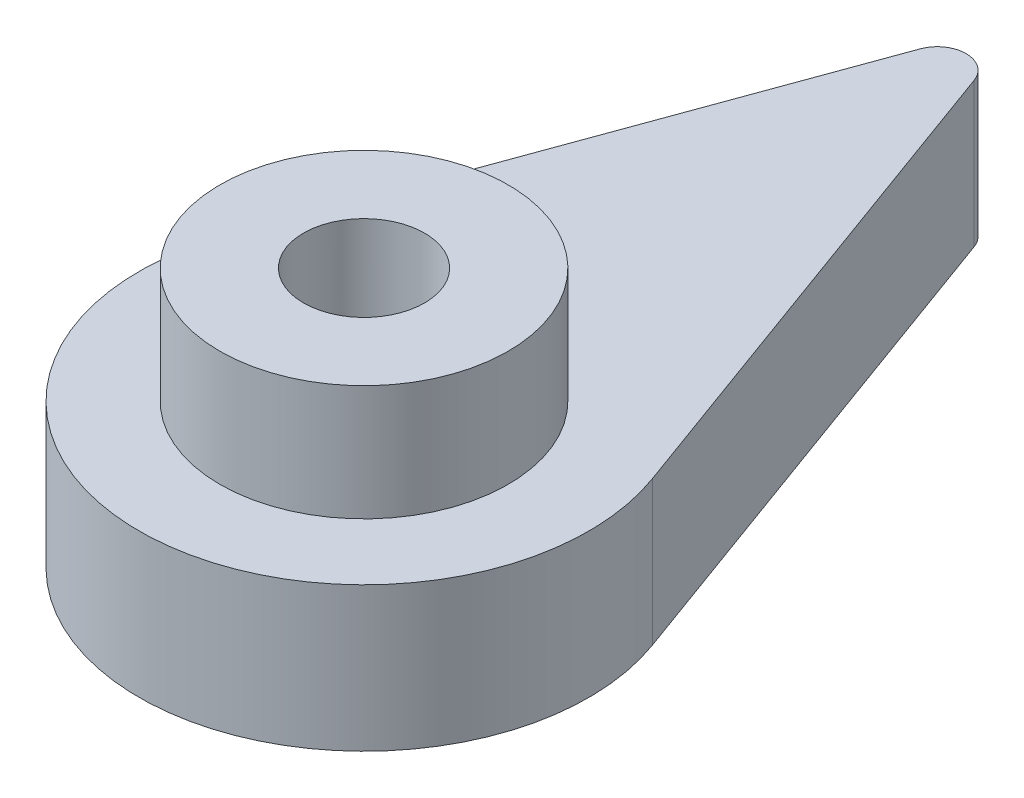
from build123d import *

# Parameters (mm, degrees)
BOSS_EXTRUDE2_DEPTH = 5
CUT_EXTRUDE1_REACH  = 24.845
SKETCH3_R           = 2.1
CUT_EXTRUDE3_DEPTH  = 1.8
BOSS_EXTRUDE3_START = 4
SKETCH6_R           = 5
SKETCH6_R_2         = 2.1
BOSS_EXTRUDE3_DEPTH = 4


with BuildPart() as part:
    # Sketch1 → Boss-Extrude2 (new body)
    with BuildSketch(Plane(origin=(0, 0, 0), x_dir=(1, 0, 0), z_dir=(0, 1, 0))):
        with BuildLine():
            Line((-0.939692556, 20.223890242), (-7.329602442, 2.667757118))
            ThreePointArc((-7.329602442, 2.667757118), (0, -7.8), (7.329602442, 2.667757118))
            Line((7.329602442, 2.667757118), (0.939692556, 20.223890242))
            ThreePointArc((0.939692556, 20.223890242), (0, 20.881870053), (-0.939692556, 20.223890242))
        make_face()
    extrude(amount=BOSS_EXTRUDE2_DEPTH)

    # Sketch3 → Cut-Extrude1 (cut, up to next)
    with BuildSketch(Plane(origin=(0, 5, 0), x_dir=(1, 0, 0), z_dir=(0, 1, 0)), mode=Mode.PRIVATE) as cut_extrude1_sk1:
        with Locations(Location((0, 0, 0), (0, 0, 270))):
            Circle(SKETCH3_R)
    cut_extrude1_tool1 = extrude(cut_extrude1_sk1.sketch, amount=-CUT_EXTRUDE1_REACH, mode=Mode.PRIVATE) & part.part
    add(cut_extrude1_tool1.solids().sort_by_distance((0, 5, 0))[0], mode=Mode.SUBTRACT)

    # Sketch5 → Cut-Extrude3 (cut)
    with BuildSketch(Plane.XZ):
        Polygon((0, 4.272391992), (-3.7, 2.136195996), (-3.7, -2.136195996), (0, -4.272391992), (3.7, -2.136195996), (3.7, 2.136195996), align=None)
    extrude(amount=-CUT_EXTRUDE3_DEPTH, mode=Mode.SUBTRACT)

    # Sketch6 → Boss-Extrude3 (add)
    with BuildSketch(Plane(origin=(0, 5, 0), x_dir=(1, 0, 0), z_dir=(0, 1, 0)).offset(BOSS_EXTRUDE3_START)):
        with Locations(Location((0, 0, 0), (0, 0, 270))):
            Circle(SKETCH6_R)
        with Locations(Location((0, 0, 0), (0, 0, 270))):
            Circle(SKETCH6_R_2, mode=Mode.SUBTRACT)
    extrude(amount=-BOSS_EXTRUDE3_DEPTH)


solid = part.part
